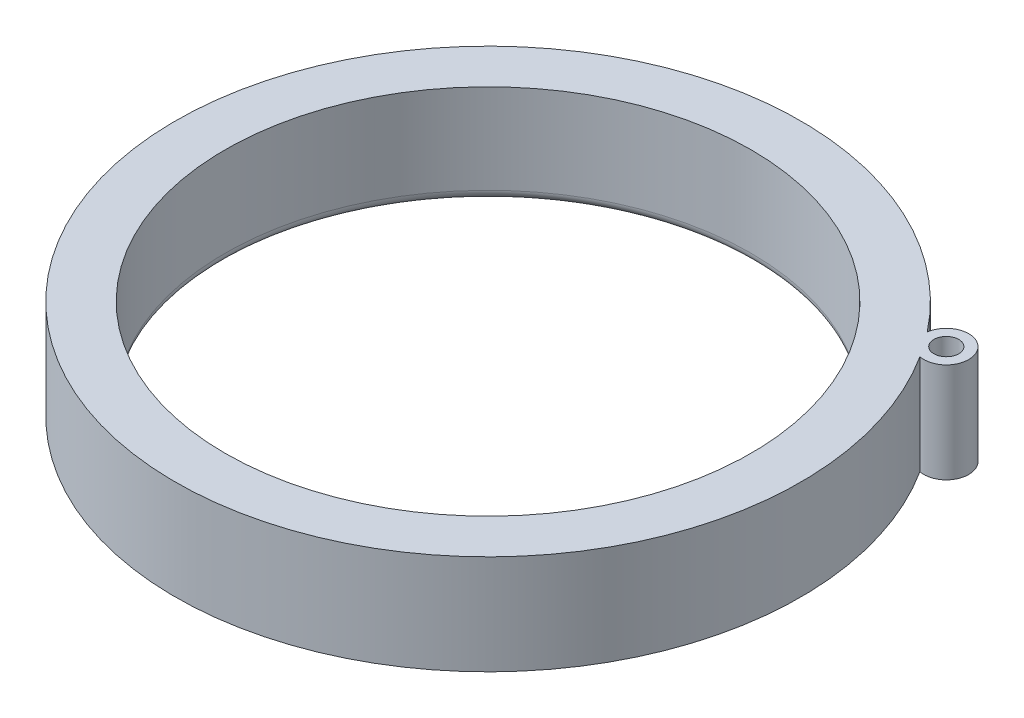
from build123d import *

# Parameters (mm, degrees)
SKETCH_1_R      = 26.4
SKETCH_1_R_2    = 1.25
EXTRUDE_1_DEPTH = 10
FILLET_1_R      = 1


with BuildPart() as part:
    # 草图1 → 凸台-拉伸1 (new body)
    with BuildSketch(Plane(origin=(0, 0, 0), x_dir=(1, 0, 0), z_dir=(0, 1, 0))):
        with BuildLine():
            ThreePointArc((24.696486218, 19.391842834), (-25.619357757, -18.155123468), (26.480356643, 16.87455813))
            ThreePointArc((26.480356643, 16.87455813), (28.760584743, 20.381149753), (24.696486218, 19.391842834))
        make_face()
        with Locations(Location((0, 0, 0), (0, 0, 270))):
            Circle(SKETCH_1_R, mode=Mode.SUBTRACT)
        with Locations(Location((26.924802738, 19.080225301, 0), (0, 0, 270))):
            Circle(SKETCH_1_R_2, mode=Mode.SUBTRACT)
    extrude(amount=EXTRUDE_1_DEPTH)

    # 圆角1
    fillet_1_edges = [part.edges().sort_by_distance(p)[0] for p in [
        (0, 0, -26.4),
    ]]
    fillet(fillet_1_edges, radius=FILLET_1_R)


solid = part.part
